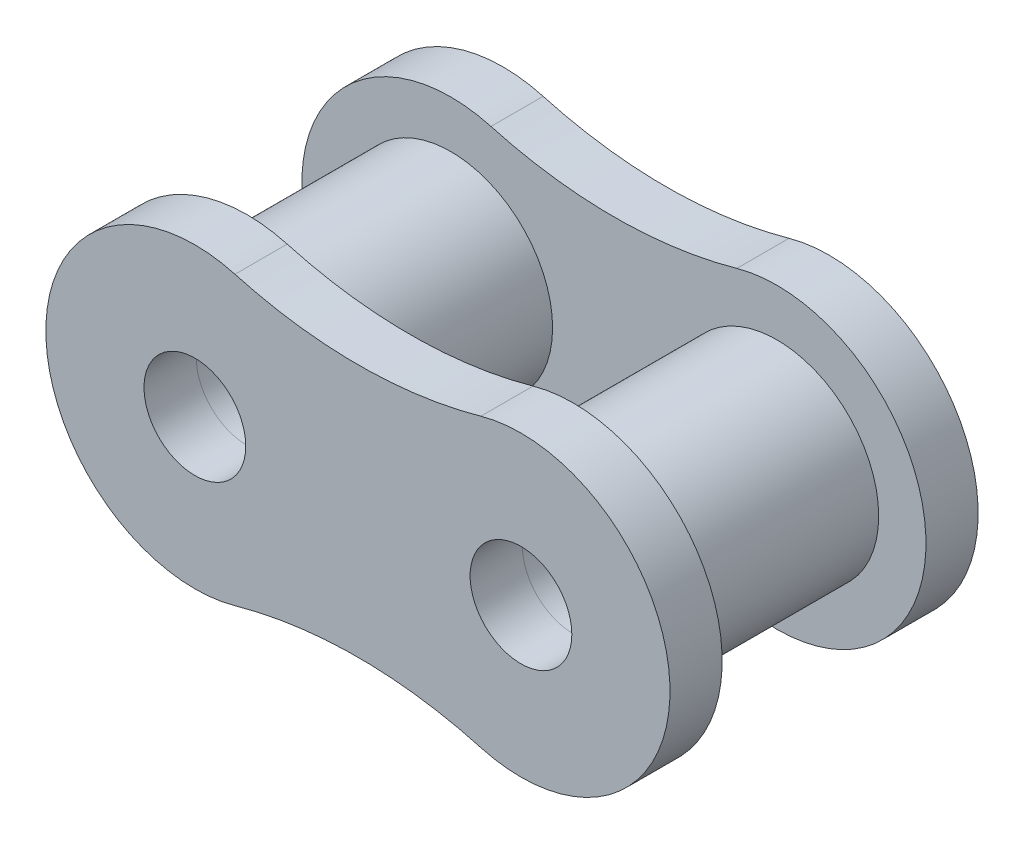
from build123d import *

# Parameters (mm, degrees)
SKETCH4_R             = 3.9624
SKETCH4_R_2           = 2.0066
BOSS_EXTRUDE1_DEPTH   = 3.96875
BOSS_EXTRUDE1_2_DEPTH = 3.96875
SKETCH5_R             = 1.9812
BOSS_EXTRUDE2_DEPTH   = 2.032


with BuildPart() as part:
    # Sketch4 → Boss-Extrude1 (new, symmetric)
    with BuildSketch(Plane.XY):
        with Locations((-6.35, 0)):
            Circle(SKETCH4_R)
        with Locations((-6.35, 0)):
            Circle(SKETCH4_R_2, mode=Mode.SUBTRACT)
    extrude(amount=BOSS_EXTRUDE1_DEPTH, both=True)


with BuildPart() as body_2:
    # Sketch4 → Boss-Extrude1 2 (new, symmetric)
    with BuildSketch(Plane.XY):
        with Locations((6.35, 0)):
            Circle(SKETCH4_R)
        with Locations((6.35, 0)):
            Circle(SKETCH4_R_2, mode=Mode.SUBTRACT)
    extrude(amount=BOSS_EXTRUDE1_2_DEPTH, both=True)


with BuildPart() as body_3:
    # Sketch5 → Boss-Extrude2 (new body)
    with BuildSketch(Plane.XY.offset(3.96875)):
        with BuildLine():
            ThreePointArc((-4.787931893, 5.589740462), (-12.1539, 0), (-4.787931893, -5.589740462))
            ThreePointArc((-4.787931893, -5.589740462), (0, -4.933315), (4.787931893, -5.589740462))
            ThreePointArc((4.787931893, -5.589740462), (12.1539, 0), (4.787931893, 5.589740462))
            ThreePointArc((4.787931893, 5.589740462), (0, 4.933315), (-4.787931893, 5.589740462))
        make_face()
        with Locations((-6.35, 0)):
            Circle(SKETCH5_R, mode=Mode.SUBTRACT)
        with Locations((6.35, 0)):
            Circle(SKETCH5_R, mode=Mode.SUBTRACT)
    extrude(amount=BOSS_EXTRUDE2_DEPTH)


with BuildPart() as body_4:
    # Mirror3: mirrored copy
    add(body_3.part.mirror(Plane.XY))

    # Combine2: union body 3, body 2, part
    add(body_3.part)
    add(body_2.part)
    add(part.part)


solid = body_4.part
